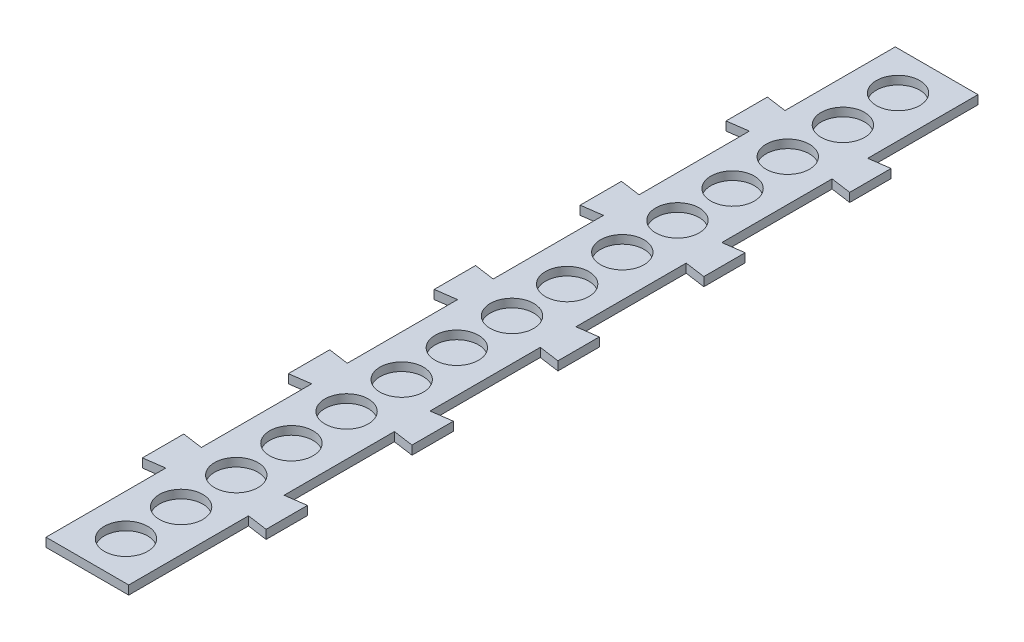
from build123d import *

# Parameters (mm, degrees)
SKETCH1_W           = 38.1
SKETCH1_H           = 391.16
BOSS_EXTRUDE1_DEPTH = 4.064
SKETCH2_R           = 10
CUT_EXTRUDE1_DEPTH  = 3.863999892
BOSS_EXTRUDE2_DEPTH = 4.064


with BuildPart() as part:
    # Sketch1 → Boss-Extrude1 (new body)
    with BuildSketch(Plane(origin=(0, 0, 0), x_dir=(1, 0, 0), z_dir=(0, 1, 0))):
        Rectangle(SKETCH1_W, SKETCH1_H)
    extrude(amount=BOSS_EXTRUDE1_DEPTH)

    # Sketch2 → Cut-Extrude1 (cut)
    with BuildSketch(Plane(origin=(0, 4.064, 0), x_dir=(1, 0, 0), z_dir=(0, 1, 0))):
        with Locations(Location((0, 177.8, 0), (0, 0, 270))):
            Circle(SKETCH2_R)
        with Locations(Location((0, 152.4, 0), (0, 0, 270))):
            Circle(SKETCH2_R)
        with Locations(Location((0, 127, 0), (0, 0, 270))):
            Circle(SKETCH2_R)
        with Locations(Location((0, 101.6, 0), (0, 0, 270))):
            Circle(SKETCH2_R)
        with Locations(Location((0, 76.2, 0), (0, 0, 270))):
            Circle(SKETCH2_R)
        with Locations(Location((0, 50.8, 0), (0, 0, 270))):
            Circle(SKETCH2_R)
        with Locations(Location((0, 25.4, 0), (0, 0, 270))):
            Circle(SKETCH2_R)
        with Locations(Location((0, 0, 0), (0, 0, 270))):
            Circle(SKETCH2_R)
        with Locations(Location((0, -25.4, 0), (0, 0, 270))):
            Circle(SKETCH2_R)
        with Locations(Location((0, -50.8, 0), (0, 0, 270))):
            Circle(SKETCH2_R)
        with Locations(Location((0, -76.2, 0), (0, 0, 270))):
            Circle(SKETCH2_R)
        with Locations(Location((0, -101.6, 0), (0, 0, 270))):
            Circle(SKETCH2_R)
        with Locations(Location((0, -127, 0), (0, 0, 270))):
            Circle(SKETCH2_R)
        with Locations(Location((0, -152.4, 0), (0, 0, 270))):
            Circle(SKETCH2_R)
        with Locations(Location((0, -177.8, 0), (0, 0, 270))):
            Circle(SKETCH2_R)
    extrude(amount=-CUT_EXTRUDE1_DEPTH, mode=Mode.SUBTRACT)

    # Sketch4 → Boss-Extrude2 (add)
    with BuildSketch(Plane(origin=(0, 0, 0), x_dir=(1, 0, 0), z_dir=(0, 1, 0))):
        Polygon((28.482303355, -55.490633493), (19.05, -56.81625728), (19.05, -73.215009707), (28.482303355, -74.540633493), align=None)
        Polygon((28.482303355, 146.105623787), (19.05, 144.78), (19.05, 128.381247573), (28.482303355, 127.055623787), align=None)
        Polygon((-19.05, 128.381247573), (-19.05, 144.78), (-28.482303355, 146.105623787), (-28.482303355, 127.055623787), align=None)
        Polygon((28.482303355, 78.90687136), (19.05, 77.581247573), (19.05, 61.182495147), (28.482303355, 59.85687136), align=None)
        Polygon((28.482303355, 11.708118933), (19.05, 10.382495147), (19.05, -6.01625728), (28.482303355, -7.341881067), align=None)
        Polygon((-19.05, -6.01625728), (-19.05, 10.382495147), (-28.482303355, 11.708118933), (-28.482303355, -7.341881067), align=None)
        Polygon((-19.05, 61.182495147), (-19.05, 77.581247573), (-28.482303355, 78.90687136), (-28.482303355, 59.85687136), align=None)
        Polygon((28.482303355, -122.68938592), (19.05, -124.015009707), (19.05, -140.413762134), (28.482303355, -141.73938592), align=None)
        Polygon((-19.05, -140.413762134), (-19.05, -124.015009707), (-28.482303355, -122.68938592), (-28.482303355, -141.73938592), align=None)
        Polygon((-19.05, -73.215009707), (-19.05, -56.81625728), (-28.482303355, -55.490633493), (-28.482303355, -74.540633493), align=None)
    extrude(amount=BOSS_EXTRUDE2_DEPTH)


solid = part.part
